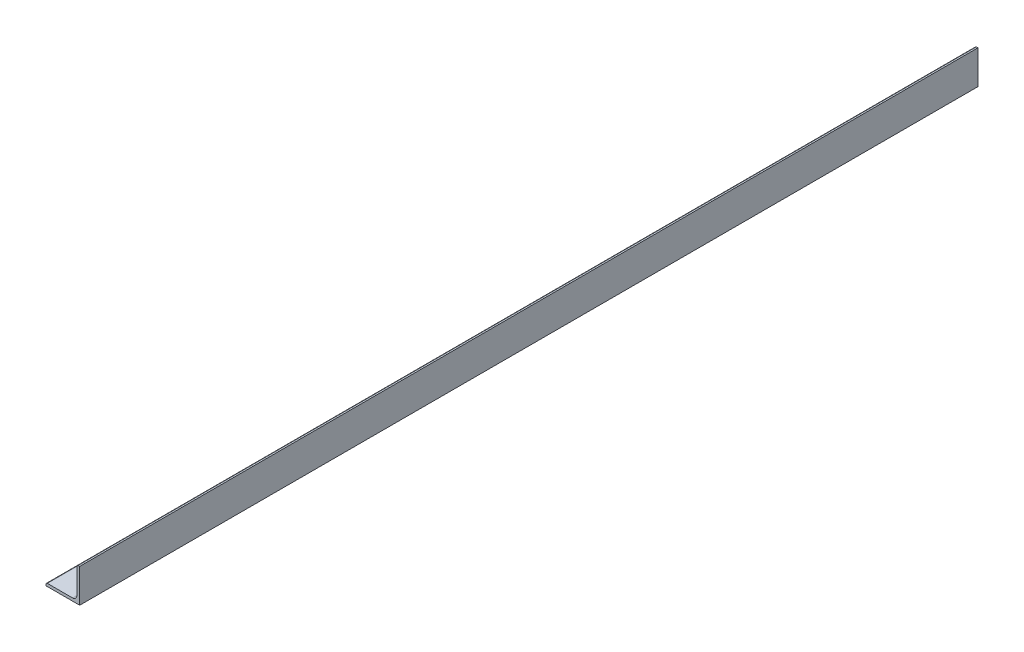
from build123d import *

# Parameters (mm, degrees)
BOSS_EXTRUDE1_DEPTH = 254


with BuildPart() as part:
    # Sketch2 → Boss-Extrude1 (new, symmetric)
    with BuildSketch(Plane.XY):
        with BuildLine():
            Line((-9.525, -9.525), (9.525, -9.525))
            Line((9.525, -9.525), (9.525, 9.525))
            Line((9.525, 9.525), (8.73125, 9.525))
            ThreePointArc((8.73125, 9.525), (8.169983992, 9.292516008), (7.9375, 8.73125))
            Line((7.9375, 8.73125), (7.9375, -5.5499))
            ThreePointArc((7.9375, -5.5499), (7.238188151, -7.238188151), (5.5499, -7.9375))
            Line((5.5499, -7.9375), (-8.73125, -7.9375))
            ThreePointArc((-8.73125, -7.9375), (-9.292516008, -8.169983992), (-9.525, -8.73125))
            Line((-9.525, -8.73125), (-9.525, -9.525))
        make_face()
    extrude(amount=BOSS_EXTRUDE1_DEPTH, both=True)


solid = part.part
